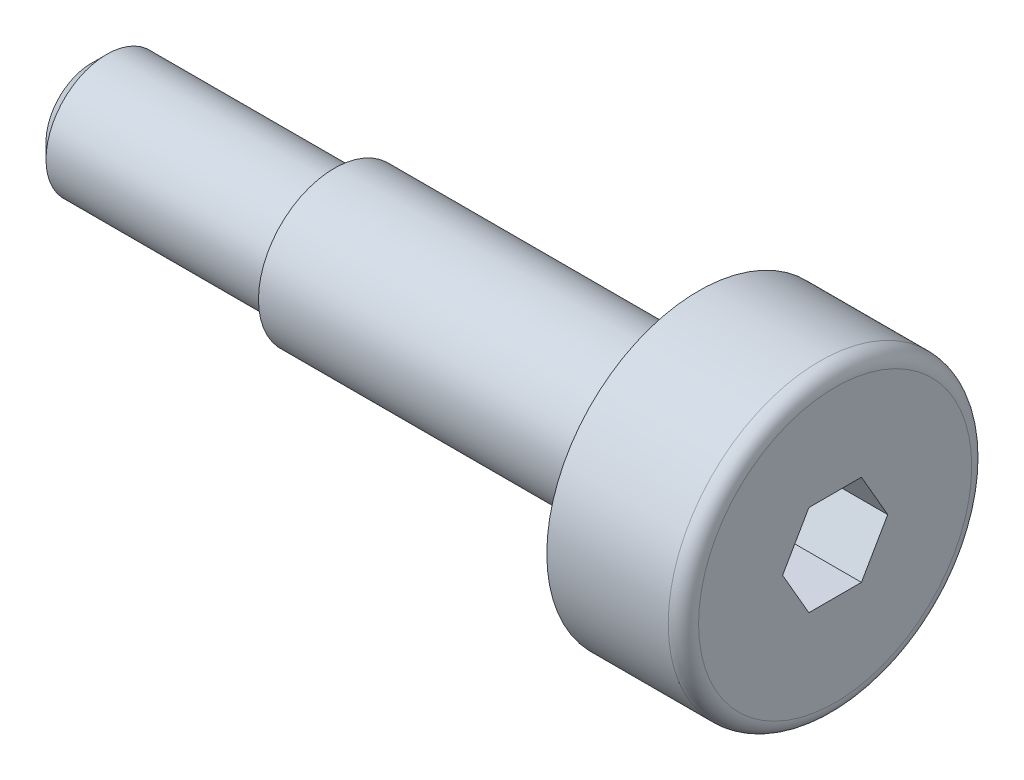
from build123d import *

# Parameters (mm, degrees)
CHAMFER1_SIZE      = 0.5
CUT_EXTRUDE1_DEPTH = 2.4


with BuildPart() as part:
    # Sketch1 → Revolve1 (revolve)
    with BuildSketch(Plane.XY):
        with BuildLine():
            Line((0, 0), (0, 4.5))
            ThreePointArc((0, 4.5), (-0.146446609, 4.853553391), (-0.5, 5))
            Line((-0.5, 5), (-4.5, 5))
            Line((-4.5, 5), (-4.5, 2.5))
            Line((-4.5, 2.5), (-16.5, 2.5))
            Line((-16.5, 2.5), (-16.5, 2))
            Line((-16.5, 2), (-24.5, 2))
            Line((-24.5, 2), (-24.5, 0))
            Line((-24.5, 0), (0, 0))
        make_face()
    revolve(axis=Axis((0, 0, 0), (1, 0, 0)))

    # Chamfer1
    chamfer1_edges = [part.edges().sort_by_distance(p)[0] for p in [
        (-24.5, -2, 0),
    ]]
    chamfer(chamfer1_edges, length=CHAMFER1_SIZE)

    # Sketch2 → Cut-Extrude1 (cut)
    with BuildSketch(Plane(origin=(0, 0, 0), x_dir=(0, 0, -1), z_dir=(1, 0, 0))):
        Polygon((1.732050808, 0), (0.866025404, 1.5), (-0.866025404, 1.5), (-1.732050808, 0), (-0.866025404, -1.5), (0.866025404, -1.5), align=None)
    extrude(amount=-CUT_EXTRUDE1_DEPTH, mode=Mode.SUBTRACT)


solid = part.part
